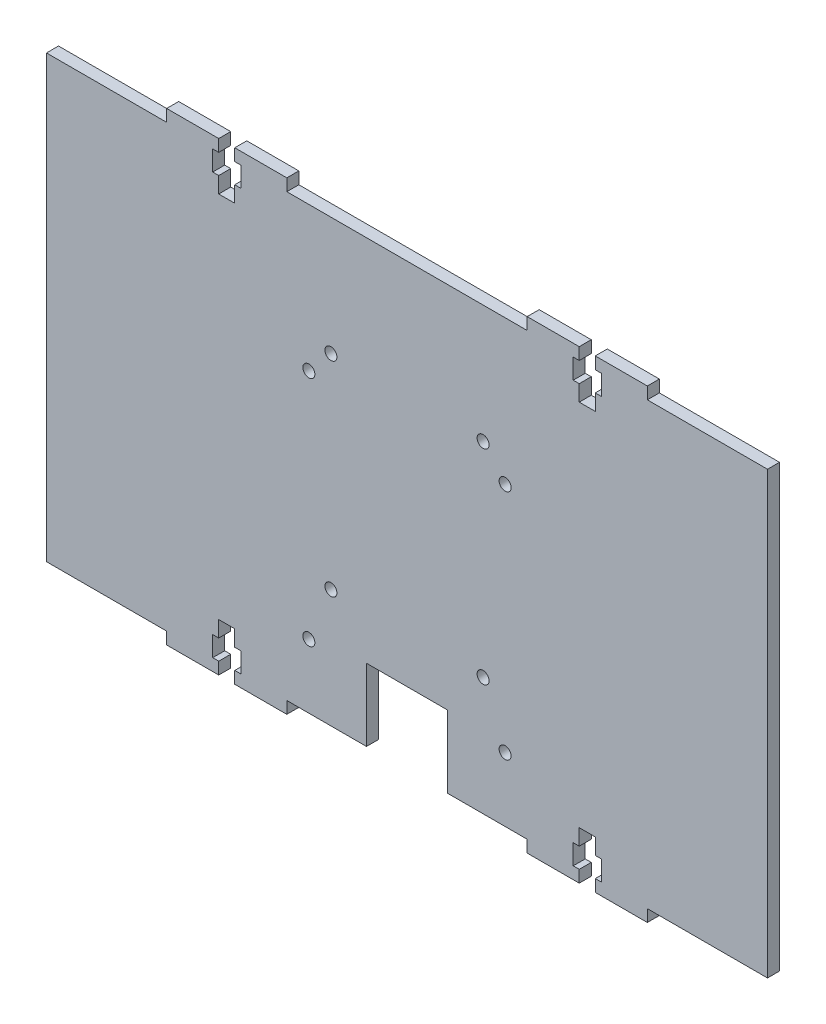
from build123d import *

# Parameters (mm, degrees)
SKETCH_1_W          = 28
SKETCH_1_H          = 42.5
SKETCH_1_R          = 1.5
EXTRUDE_1_DEPTH     = 3
SKETCH1_W           = 20.227510382
SKETCH1_H           = 18
CUT_EXTRUDE1_DEPTH  = 10
CUT_EXTRUDE_1_DEPTH = 213.55117031


with BuildPart() as part:
    # 草图1 → 凸台-拉伸1 (new body)
    # profile 1 of 16: a face of its own
    with BuildSketch(Plane.XY):
        Polygon((41.5, 0), (43, 0), (43, 3), (30, 3), (30, 0), align=None)
    # profile 2 of 16: a face of its own
    with BuildSketch(Plane.XY):
        Polygon((48.5, 0), (60, 0), (60, 3), (47, 3), (47, 0), align=None)
    # profile 3 of 16: a face of its own
    with BuildSketch(Plane.XY):
        Polygon((120, 3), (120, 0), (131.5, 0), (133, 0), (133, 3), align=None)
    # profile 4 of 16: a face of its own
    with BuildSketch(Plane.XY):
        Polygon((137, 3), (137, 0), (138.5, 0), (150, 0), (150, 3), align=None)
    # profile 5 of 16: a face of its own
    with BuildSketch(Plane.XY):
        Polygon((120, 0), (90, 0), (90, -12.5), (118, -12.5), (118, -55), (180, -55), (180, 0), (150, 0), (138.5, 0), (138.5, -5), (137, -5), (137, -9), (133, -9), (133, -5), (131.5, -5), (131.5, 0), align=None)
    # profile 6 of 16: a face of its own
    with BuildSketch(Plane.XY):
        Polygon((90, -12.5), (90, 0), (60, 0), (48.5, 0), (48.5, -5), (47, -5), (47, -9), (43, -9), (43, -5), (41.5, -5), (41.5, 0), (30, 0), (0, 0), (0, -55), (62, -55), (62, -12.5), align=None)
    # profile 7 of 16: a face of its own
    with BuildSketch(Plane.XY):
        with Locations((76, -33.75)):
            Rectangle(SKETCH_1_W, SKETCH_1_H)
        with Locations((65.5, -36)):
            Circle(SKETCH_1_R, mode=Mode.SUBTRACT)
    # profile 8 of 16: a face of its own
    with BuildSketch(Plane.XY):
        with Locations((104, -33.75)):
            Rectangle(SKETCH_1_W, SKETCH_1_H)
        with Locations((114.5, -36)):
            Circle(SKETCH_1_R, mode=Mode.SUBTRACT)
    # profile 9 of 16: a face of its own
    with BuildSketch(Plane.XY):
        Polygon((41.5, -110), (30, -110), (30, -113), (43, -113), (43, -110), align=None)
    # profile 10 of 16: a face of its own
    with BuildSketch(Plane.XY):
        Polygon((60, -113), (60, -110), (48.5, -110), (47, -110), (47, -113), align=None)
    # profile 11 of 16: a face of its own
    with BuildSketch(Plane.XY):
        Polygon((131.5, -110), (120, -110), (120, -113), (133, -113), (133, -110), align=None)
    # profile 12 of 16: a face of its own
    with BuildSketch(Plane.XY):
        Polygon((150, -113), (150, -110), (138.5, -110), (137, -110), (137, -113), align=None)
    # profile 13 of 16: a face of its own
    with BuildSketch(Plane.XY):
        Polygon((118, -97.5), (90, -97.5), (90, -110), (120, -110), (131.5, -110), (131.5, -105), (133, -105), (133, -101), (137, -101), (137, -105), (138.5, -105), (138.5, -110), (150, -110), (180, -110), (180, -55), (118, -55), align=None)
    # profile 14 of 16: a face of its own
    with BuildSketch(Plane.XY):
        Polygon((90, -110), (90, -97.5), (62, -97.5), (62, -55), (0, -55), (0, -110), (30, -110), (41.5, -110), (41.5, -105), (43, -105), (43, -101), (47, -101), (47, -105), (48.5, -105), (48.5, -110), (60, -110), align=None)
    # profile 15 of 16: a face of its own
    with BuildSketch(Plane.XY):
        with Locations((76, -76.25)):
            Rectangle(SKETCH_1_W, SKETCH_1_H)
        with Locations((65.5, -94)):
            Circle(SKETCH_1_R, mode=Mode.SUBTRACT)
    # profile 16 of 16: a face of its own
    with BuildSketch(Plane.XY):
        with Locations((104, -76.25)):
            Rectangle(SKETCH_1_W, SKETCH_1_H)
        with Locations((114.5, -94)):
            Circle(SKETCH_1_R, mode=Mode.SUBTRACT)
    extrude(amount=EXTRUDE_1_DEPTH)

    # Sketch1 → Cut-Extrude1 (cut)
    with BuildSketch(Plane.XY.offset(3)):
        with Locations((90, -101)):
            Rectangle(SKETCH1_W, SKETCH1_H)
    extrude(amount=-CUT_EXTRUDE1_DEPTH, mode=Mode.SUBTRACT)

    # 草图2 → 切除-拉伸1 (cut, through all)
    with BuildSketch(Plane.XY.offset(3)):
        with BuildLine():
            ThreePointArc((72.5, -29.5), (69.939339828, -28.439339828), (71, -31))
            Line((71, -31), (71, -29.5))
            Line((71, -29.5), (72.5, -29.5))
        make_face()
        with BuildLine():
            Line((71, -29.5), (71, -31))
            ThreePointArc((71, -31), (72.060660172, -30.560660172), (72.5, -29.5))
            Line((72.5, -29.5), (71, -29.5))
        make_face()
        with BuildLine():
            ThreePointArc((107.5, -29.5), (107.939339828, -30.560660172), (109, -31))
            Line((109, -31), (109, -29.5))
            Line((109, -29.5), (107.5, -29.5))
        make_face()
        with BuildLine():
            Line((109, -29.5), (109, -31))
            ThreePointArc((109, -31), (110.060660172, -30.560660172), (110.5, -29.5))
            ThreePointArc((110.5, -29.5), (109, -28), (107.5, -29.5))
            Line((107.5, -29.5), (109, -29.5))
        make_face()
        with BuildLine():
            ThreePointArc((72.5, -80.5), (72.060660172, -79.439339828), (71, -79))
            Line((71, -79), (71, -80.5))
            Line((71, -80.5), (72.5, -80.5))
        make_face()
        with BuildLine():
            Line((71, -80.5), (71, -79))
            ThreePointArc((71, -79), (69.939339828, -81.560660172), (72.5, -80.5))
            Line((72.5, -80.5), (71, -80.5))
        make_face()
        with BuildLine():
            ThreePointArc((110.5, -80.5), (110.060660172, -79.439339828), (109, -79))
            Line((109, -79), (109, -80.5))
            Line((109, -80.5), (107.5, -80.5))
            ThreePointArc((107.5, -80.5), (109, -82), (110.5, -80.5))
        make_face()
        with BuildLine():
            Line((109, -80.5), (109, -79))
            ThreePointArc((109, -79), (107.939339828, -79.439339828), (107.5, -80.5))
            Line((107.5, -80.5), (109, -80.5))
        make_face()
    extrude(amount=-CUT_EXTRUDE_1_DEPTH, mode=Mode.SUBTRACT)


solid = part.part
